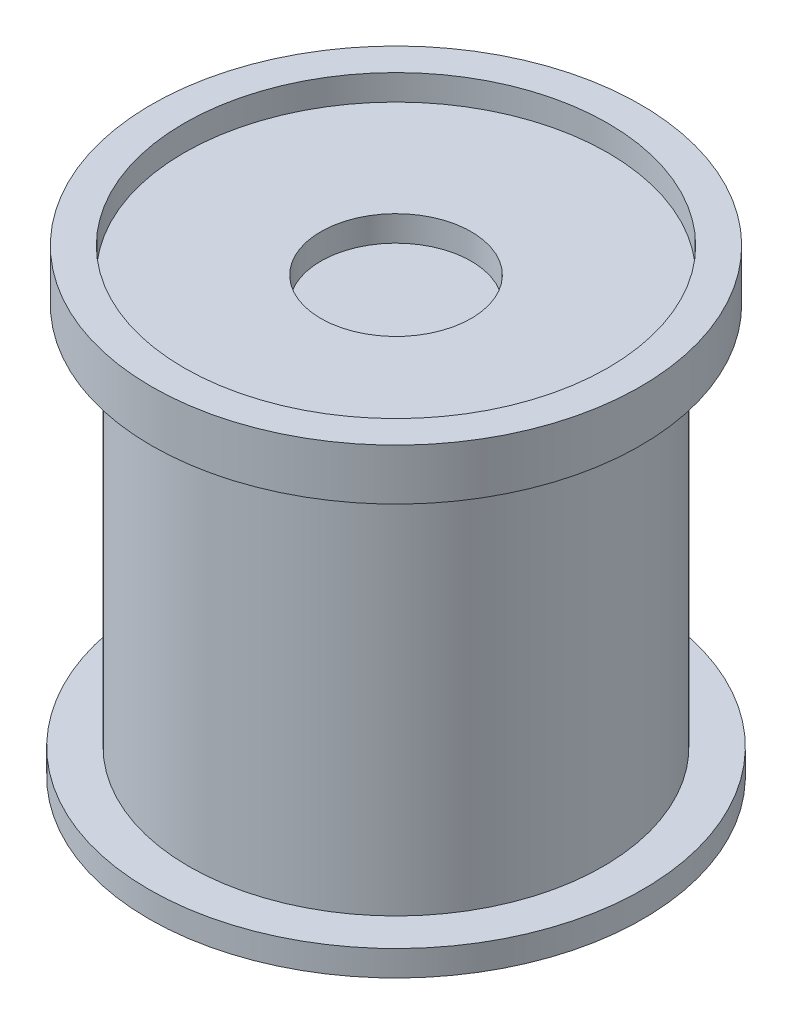
from build123d import *

# Parameters (mm, degrees)
SKETCH1_R           = 9.67330264
BOSS_EXTRUDE1_DEPTH = 1
SKETCH2_R           = 8.112606278
BOSS_EXTRUDE2_DEPTH = 15
SKETCH3_R           = 9.572114115
BOSS_EXTRUDE3_DEPTH = 2
SKETCH4_R           = 8.298124112
CUT_EXTRUDE2_DEPTH  = 1
SKETCH5_R           = 2.945552355
CUT_EXTRUDE3_DEPTH  = 1


with BuildPart() as part:
    # Sketch1 → Boss-Extrude1 (new body)
    with BuildSketch(Plane(origin=(0, 0, 0), x_dir=(1, 0, 0), z_dir=(0, 1, 0))):
        with Locations(Location((0, 0, 0), (0, 0, 270))):
            Circle(SKETCH1_R)
    extrude(amount=BOSS_EXTRUDE1_DEPTH)

    # Sketch2 → Boss-Extrude2 (add)
    with BuildSketch(Plane(origin=(0, 1, 0), x_dir=(1, 0, 0), z_dir=(0, 1, 0))):
        with Locations(Location((0, 0, 0), (0, 0, 270))):
            Circle(SKETCH2_R)
    extrude(amount=BOSS_EXTRUDE2_DEPTH)

    # Sketch3 → Boss-Extrude3 (add)
    with BuildSketch(Plane(origin=(0, 16, 0), x_dir=(1, 0, 0), z_dir=(0, 1, 0))):
        with Locations(Location((0, 0, 0), (0, 0, 270))):
            Circle(SKETCH3_R)
    extrude(amount=BOSS_EXTRUDE3_DEPTH)

    # Sketch4 → Cut-Extrude2 (cut)
    with BuildSketch(Plane(origin=(0, 18, 0), x_dir=(1, 0, 0), z_dir=(0, 1, 0))):
        with Locations(Location((0, 0, 0), (0, 0, 270))):
            Circle(SKETCH4_R)
    extrude(amount=-CUT_EXTRUDE2_DEPTH, mode=Mode.SUBTRACT)

    # Sketch5 → Cut-Extrude3 (cut)
    with BuildSketch(Plane(origin=(0, 17, 0), x_dir=(1, 0, 0), z_dir=(0, 1, 0))):
        with Locations(Location((0, 0, 0), (0, 0, 270))):
            Circle(SKETCH5_R)
    extrude(amount=-CUT_EXTRUDE3_DEPTH, mode=Mode.SUBTRACT)


solid = part.part
